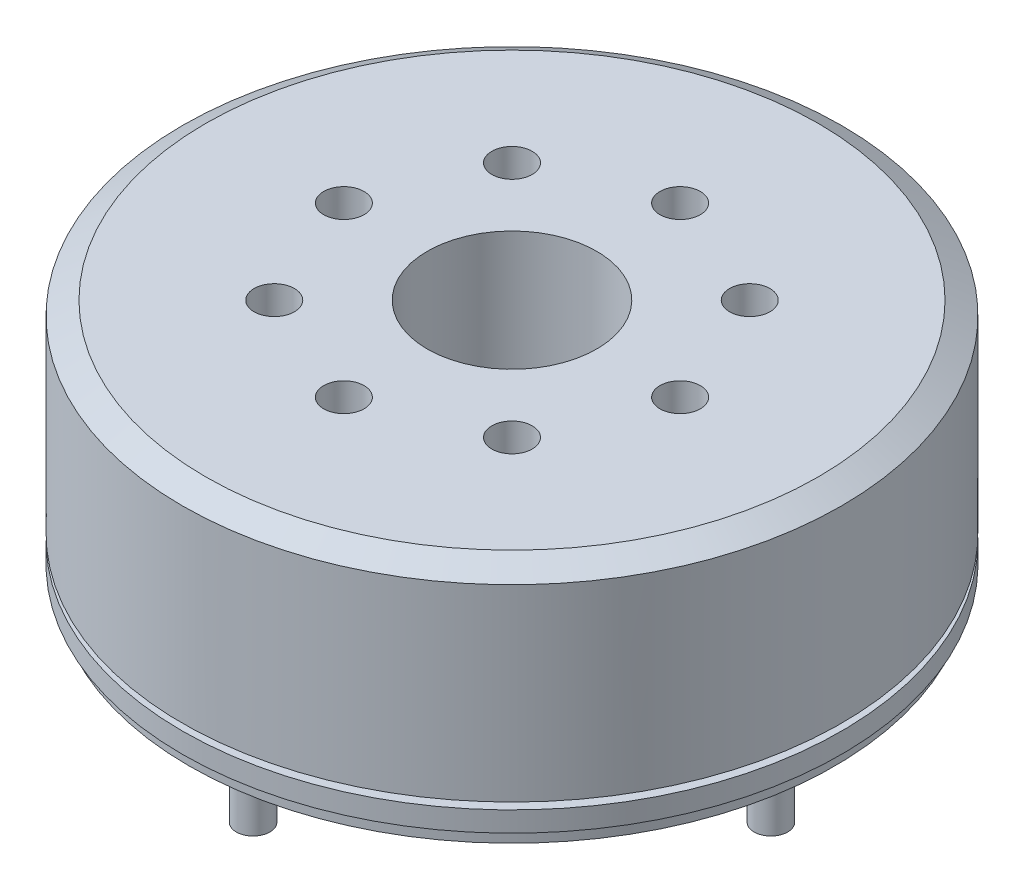
from build123d import *

# Parameters (mm, degrees)
SKETCH_1_R               = 24.5
EXTRUDE_1_DEPTH          = 17
SKETCH_3_W               = 2.337455655
SKETCH_3_H               = 0.503987985
CHAMFER_1_SIZE           = 1
CHAMFER_1_SIZE2          = 1.732050808
SKETCH_4_R               = 24
EXTRUDE_2_DEPTH          = 1
SKETCH_5_R               = 8.3
EXTRUDE_3_DEPTH          = 1
SKETCH_6_R               = 6.3
CUT_EXTRUDE_1_DEPTH      = 14
SKETCH_7_R               = 4
CUT_EXTRUDE_2_DEPTH      = 3
SKETCH_8_R               = 2.5
CUT_EXTRUDE_3_DEPTH      = 2
SKETCH_9_R               = 1.5
CUT_EXTRUDE_4_DEPTH      = 3
PATTERN_CIRCULAR_1_COUNT = 8
SKETCH_12_R              = 1.5
CUT_EXTRUDE_5_DEPTH      = 3
PATTERN_CIRCULAR_2_COUNT = 4
SKETCH_15_R              = 1.25
CUT_EXTRUDE_8_DEPTH      = 1
PATTERN_CIRCULAR_4_COUNT = 4
SKETCH_16_R              = 1.25
EXTRUDE_4_DEPTH          = 6
PATTERN_CIRCULAR_5_COUNT = 4


with BuildPart() as part:
    # 草图1 → 凸台-拉伸1 (new body)
    with BuildSketch(Plane(origin=(0, 0, 0), x_dir=(1, 0, 0), z_dir=(0, 1, 0))):
        with Locations(Location((0, 0, 0), (0, 0, 270))):
            Circle(SKETCH_1_R)
    extrude(amount=EXTRUDE_1_DEPTH)

    # 草图3 → 切除-旋转1 (revolve, cut)
    with BuildSketch(Plane(origin=(0, 0, 0), x_dir=(0, 0, -1), z_dir=(1, 0, 0)), mode=Mode.PRIVATE) as cut_revolve_1_sk:
        with Locations((-24.668727827, 1.751993993)):
            Rectangle(SKETCH_3_W, SKETCH_3_H)
    revolve(cut_revolve_1_sk.sketch.rotate(Axis((0, 0, 0), (0, 1, 0)), 180), axis=Axis((0, 0, 0), (0, 1, 0)), mode=Mode.SUBTRACT)

    # 倒角1
    chamfer_1_edges = [part.edges().sort_by_distance(p)[0] for p in [
        (0, 17, -24.5),
    ]]
    chamfer_1_side = [part.faces().sort_by_distance(p)[0] for p in [
        (0, 9.501993992, -24.5),
    ]]
    chamfer(chamfer_1_edges, length=CHAMFER_1_SIZE, length2=CHAMFER_1_SIZE2, reference=chamfer_1_side[0])

    # 草图4 → 凸台-拉伸2 (add)
    with BuildSketch(Plane.XZ):
        with Locations(Location((0, 0, 0), (0, 0, 270))):
            Circle(SKETCH_4_R)
    extrude(amount=EXTRUDE_2_DEPTH)

    # 草图5 → 凸台-拉伸3 (add)
    with BuildSketch(Plane.XZ.offset(1)):
        with Locations(Location((0, 0, 0), (0, 0, 270))):
            Circle(SKETCH_5_R)
    extrude(amount=EXTRUDE_3_DEPTH)

    # 草图6 → 切除-拉伸1 (cut)
    with BuildSketch(Plane(origin=(0, 17, 0), x_dir=(1, 0, 0), z_dir=(0, 1, 0))):
        with Locations(Location((0, 0, 0), (0, 0, 270))):
            Circle(SKETCH_6_R)
    extrude(amount=-CUT_EXTRUDE_1_DEPTH, mode=Mode.SUBTRACT)

    # 草图7 → 切除-拉伸2 (cut)
    with BuildSketch(Plane(origin=(0, 3, 0), x_dir=(1, 0, 0), z_dir=(0, 1, 0))):
        with Locations(Location((0, 0, 0), (0, 0, 270))):
            Circle(SKETCH_7_R)
    extrude(amount=-CUT_EXTRUDE_2_DEPTH, mode=Mode.SUBTRACT)

    # 草图8 → 切除-拉伸3 (cut)
    with BuildSketch(Plane(origin=(0, 0, 0), x_dir=(1, 0, 0), z_dir=(0, 1, 0))):
        with Locations(Location((0, 0, 0), (0, 0, 270))):
            Circle(SKETCH_8_R)
    extrude(amount=-CUT_EXTRUDE_3_DEPTH, mode=Mode.SUBTRACT)

    # 草图9 → 切除-拉伸4 (cut)
    with BuildSketch(Plane(origin=(0, 17, 0), x_dir=(1, 0, 0), z_dir=(0, 1, 0))):
        with Locations(Location((0, 12.5, 0), (0, 0, 270))):
            Circle(SKETCH_9_R)
    cut_extrude_4 = extrude(amount=-CUT_EXTRUDE_4_DEPTH, mode=Mode.SUBTRACT)

    # 阵列(圆周)1: 切除-拉伸4 ×8 about axis
    pattern_circular_1_axis = Axis((0, 0, 0), (0, 1, 0))
    for i in range(1, PATTERN_CIRCULAR_1_COUNT):
        add(cut_extrude_4.rotate(pattern_circular_1_axis, i * 360 / PATTERN_CIRCULAR_1_COUNT), mode=Mode.SUBTRACT)

    # 草图12 → 切除-拉伸5 (cut)
    with BuildSketch(Plane.XZ.offset(1)):
        with Locations(Location((0, 15, 0), (0, 0, 270))):
            Circle(SKETCH_12_R)
    cut_extrude_5 = extrude(amount=-CUT_EXTRUDE_5_DEPTH, mode=Mode.SUBTRACT)

    # 阵列(圆周)2: 切除-拉伸5 ×4 about axis
    pattern_circular_2_axis = Axis((0, 0, 0), (0, 1, 0))
    for i in range(1, PATTERN_CIRCULAR_2_COUNT):
        add(cut_extrude_5.rotate(pattern_circular_2_axis, i * 360 / PATTERN_CIRCULAR_2_COUNT), mode=Mode.SUBTRACT)

    # 草图15 → 切除-拉伸8 (cut)
    with BuildSketch(Plane.XZ.offset(2)):
        with Locations(Location((0, 5.172485404, 0), (0, 0, 270))):
            Circle(SKETCH_15_R)
    cut_extrude_8 = extrude(amount=-CUT_EXTRUDE_8_DEPTH, mode=Mode.SUBTRACT)

    # 阵列(圆周)4: 切除-拉伸8 ×4 about axis
    pattern_circular_4_axis = Axis((0, 0, 0), (0, 1, 0))
    for i in range(1, PATTERN_CIRCULAR_4_COUNT):
        add(cut_extrude_8.rotate(pattern_circular_4_axis, i * 360 / PATTERN_CIRCULAR_4_COUNT), mode=Mode.SUBTRACT)

    # 草图16 → 凸台-拉伸4 (add)
    with BuildSketch(Plane.XZ.offset(1)):
        with Locations(Location((0, 19.25, 0), (0, 0, 270))):
            Circle(SKETCH_16_R)
    extrude_4 = extrude(amount=EXTRUDE_4_DEPTH)

    # 阵列(圆周)5: 凸台-拉伸4 ×4 about axis
    pattern_circular_5_axis = Axis((0, 0, 0), (0, 1, 0))
    for i in range(1, PATTERN_CIRCULAR_5_COUNT):
        add(extrude_4.rotate(pattern_circular_5_axis, i * 360 / PATTERN_CIRCULAR_5_COUNT))


solid = part.part
